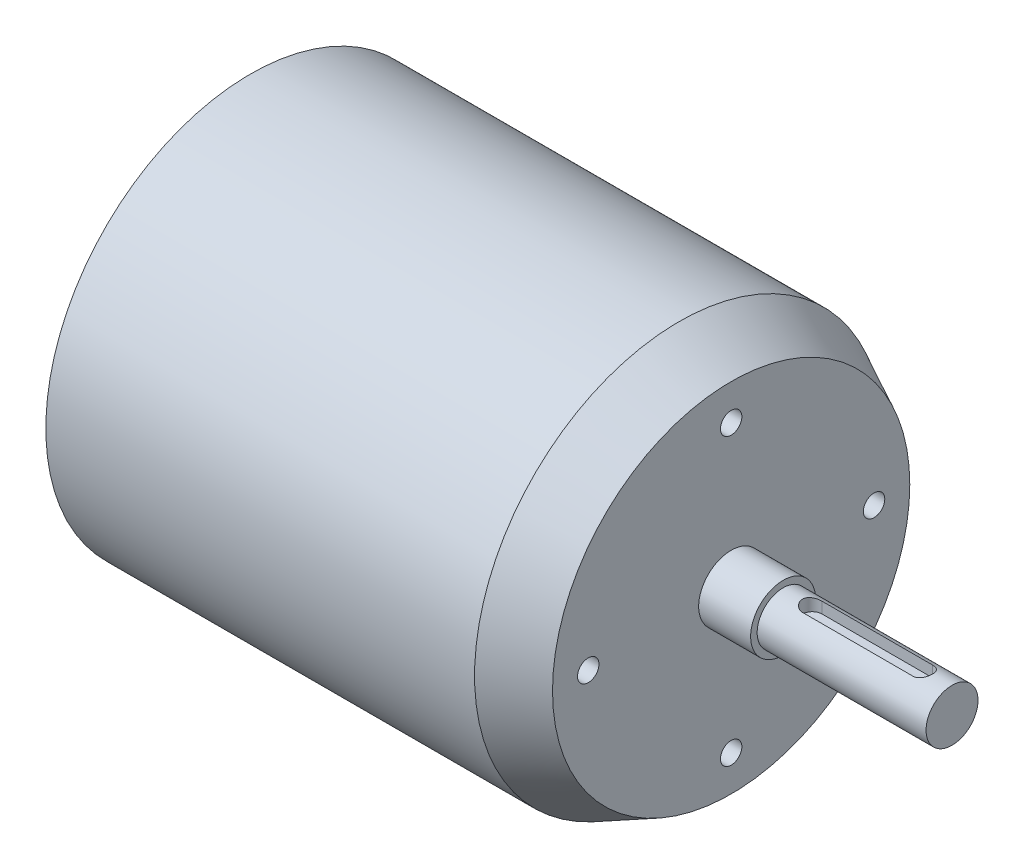
from build123d import *

# Parameters (mm, degrees)
SKETCH_1_R          = 31.5
EXTRUDE_1_DEPTH     = 74
SKETCH_2_R          = 5
EXTRUDE_2_DEPTH     = 8
SKETCH_3_R          = 4
EXTRUDE_3_DEPTH     = 26
CUT_EXTRUDE_1_DEPTH = 2
M4X0_7_1_D          = 3.3
M4X0_7_1_DEPTH      = 10.1
M4X0_7_1_TIP        = 0.991420021


with BuildPart() as part:
    # 草图1 → 凸台-拉伸1 (new body)
    with BuildSketch(Plane(origin=(0, 0, 0), x_dir=(0, 0, -1), z_dir=(1, 0, 0))):
        Circle(SKETCH_1_R)
    extrude(amount=-EXTRUDE_1_DEPTH)

    # 草图2 → 凸台-拉伸2 (add)
    with BuildSketch(Plane(origin=(0, 0, 0), x_dir=(0, 0, -1), z_dir=(1, 0, 0))):
        Circle(SKETCH_2_R)
    extrude(amount=EXTRUDE_2_DEPTH)

    # 草图3 → 凸台-拉伸3 (add)
    with BuildSketch(Plane(origin=(8, 0, 0), x_dir=(0, 0, -1), z_dir=(1, 0, 0))):
        with Locations(Location((0, 0, 0), (0, 0, 180))):
            Circle(SKETCH_3_R)
    extrude(amount=EXTRUDE_3_DEPTH)

    # Sketch 3D_1 → 切除-拉伸1 (cut)
    with BuildSketch(Plane(origin=(12.5, 4, 1.5), x_dir=(0.9847835588179368, 0, -0.17378533390904766), z_dir=(0, -1, 0))):
        with BuildLine():
            Line((0, 0), (16.7413205, 2.954350676))
            ThreePointArc((16.7413205, 2.954350676), (18.479173839, 1.737853339), (17.262676502, 0))
            Line((17.262676502, 0), (0.521356002, -2.954350676))
            ThreePointArc((0.521356002, -2.954350676), (-1.216497337, -1.737853339), (0, 0))
        make_face()
    extrude(amount=CUT_EXTRUDE_1_DEPTH, mode=Mode.SUBTRACT)

    # M4x0.7 螺纹孔1
    with Locations(Plane(origin=(0, 22, 0), x_dir=(0, 0, 1), z_dir=(1, 0, 0))):
        with Locations((0, 0), (-22, 22), (0, 44), (22, 22)):
            Hole(M4X0_7_1_D / 2, depth=M4X0_7_1_DEPTH)
            with Locations((0, 0, -(M4X0_7_1_DEPTH + M4X0_7_1_TIP / 2))):  # 118° drill point
                Cone(0, M4X0_7_1_D / 2, M4X0_7_1_TIP, mode=Mode.SUBTRACT)

    # 草图9 → 切除-旋转1 (revolve, cut)
    with BuildSketch(Plane.XY, mode=Mode.PRIVATE) as cut_revolve_1_sk:
        Polygon((0, 31.5), (0, 27.5), (-8, 31.5), align=None)
    revolve(cut_revolve_1_sk.sketch.rotate(Axis((0, 0, 0), (-1, 0, 0)), 90), axis=Axis((0, 0, 0), (-1, 0, 0)), mode=Mode.SUBTRACT)


solid = part.part
